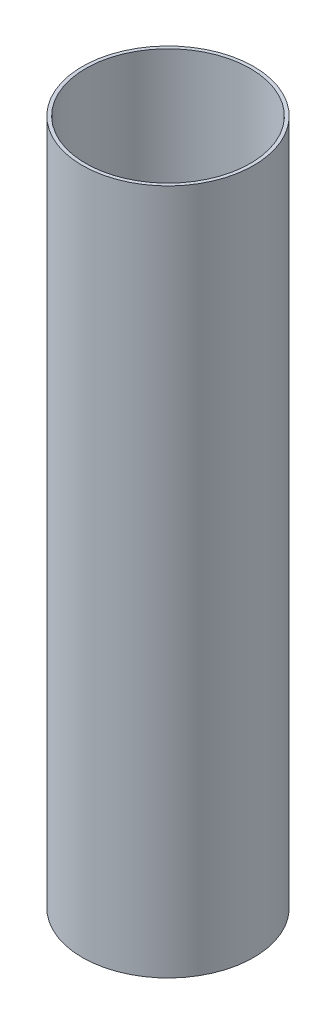
from build123d import *

# Parameters (mm, degrees)
SKETCH1_R           = 39.6748
SKETCH1_R_2         = 38.1
BOSS_EXTRUDE1_DEPTH = 158.75


with BuildPart() as part:
    # Sketch1 → Boss-Extrude1 (new, symmetric)
    with BuildSketch(Plane(origin=(0, 0, 0), x_dir=(1, 0, 0), z_dir=(0, 1, 0))):
        with Locations(Location((0, 0, 0), (0, 0, 90))):
            Circle(SKETCH1_R)
        with Locations(Location((0, 0, 0), (0, 0, 90))):
            Circle(SKETCH1_R_2, mode=Mode.SUBTRACT)
    extrude(amount=BOSS_EXTRUDE1_DEPTH, both=True)


solid = part.part
